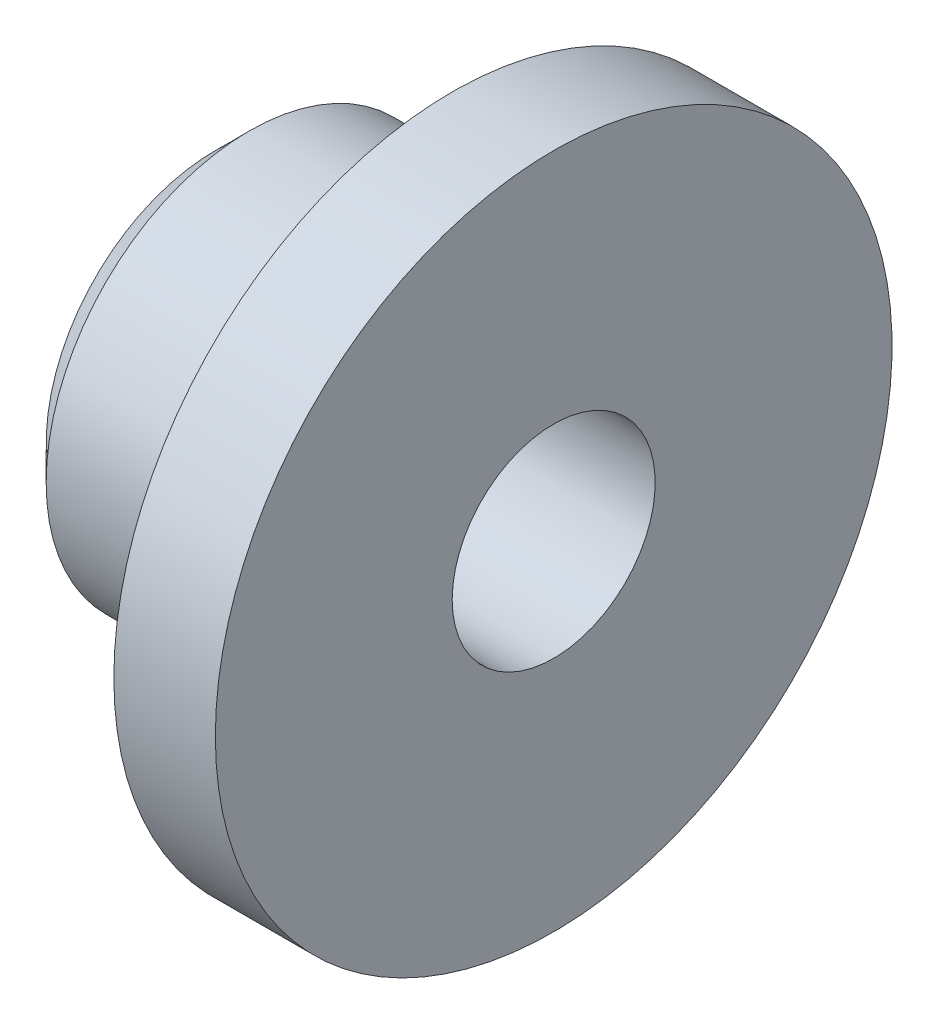
from build123d import *

# Parameters (mm, degrees)
CHANFREIN1_SIZE = 0.5


with BuildPart() as part:
    # Esquisse1 → Révolution1 (revolve)
    with BuildSketch(Plane(origin=(0, 0, -20.980989745), x_dir=(-1, 0, 0), z_dir=(0, 0, -1)), mode=Mode.PRIVATE) as r_volution1_sk:
        Polygon((176.591924368, 38.325618202), (176.591924368, 34.825618202), (178.091924368, 34.825618202), (178.091924368, 36.825618202), (181.591924368, 36.825618202), (181.591924368, 38.325618202), align=None)
    revolve(r_volution1_sk.sketch.rotate(Axis((-182.472480167, 39.825618202, -20.980989745), (1, 0, 0)), 270), axis=Axis((-182.472480167, 39.825618202, -20.980989745), (1, 0, 0)))

    # Chanfrein1
    chanfrein1_edges = [part.edges().sort_by_distance(p)[0] for p in [
        (-181.591924368, 39.825618202, -23.980989745),
    ]]
    chamfer(chanfrein1_edges, length=CHANFREIN1_SIZE)


solid = part.part
